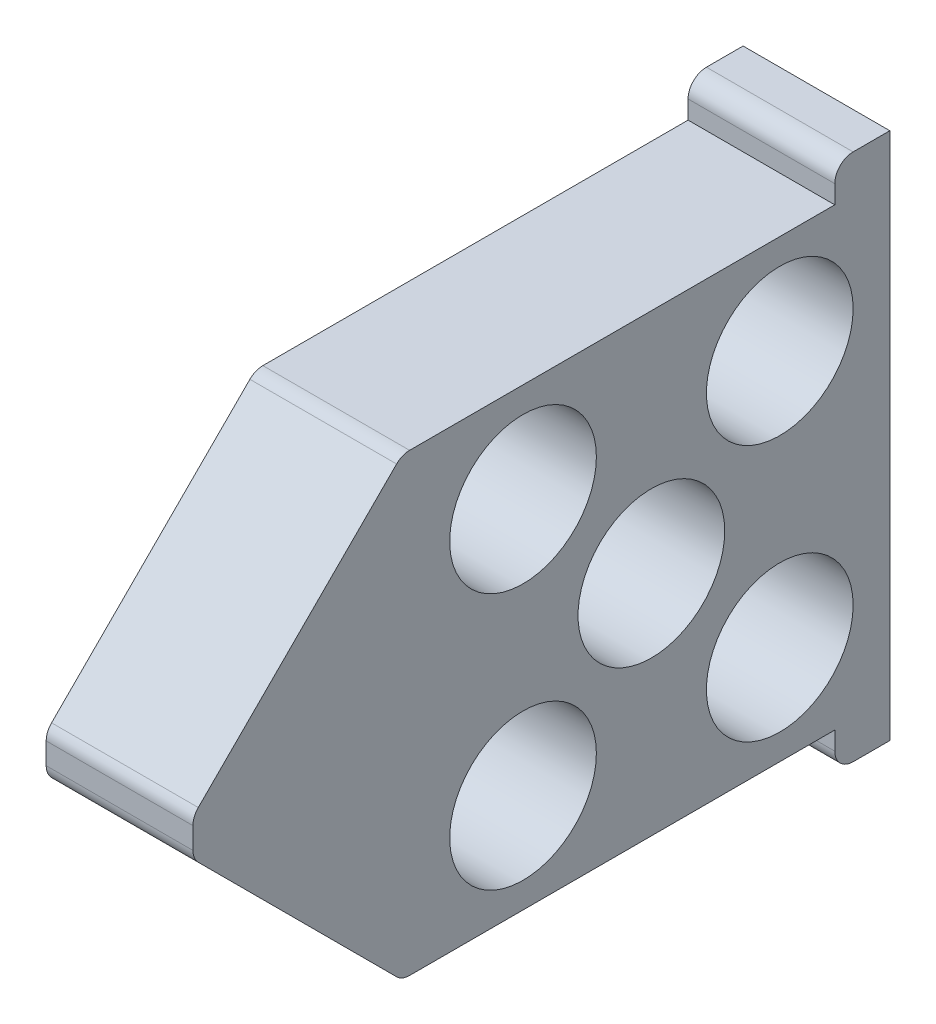
from build123d import *

# Parameters (mm, degrees)
BOSS_EXTRUDE1_DEPTH                = 4
FILLET2_R                          = 0.5
F_4_0MM_MASS_REDUCTION_HOLES_D     = 4
F_4_0MM_MASS_REDUCTION_HOLES_DEPTH = 9.525
F_4_0MM_MASS_REDUCTION_HOLES_TIP   = 1.201721238


with BuildPart() as part:
    # Sketch1 → Boss-Extrude1 (new body)
    with BuildSketch(Plane(origin=(0, 0, 0), x_dir=(0, 0, -1), z_dir=(1, 0, 0))):
        Polygon((-5.8, 6.2), (-11.5, 0.5), (-11.5, -0.5), (-5.8, -6.2), (6, -6.2), (6, -7.2), (7.5, -7.2), (7.5, 7.2), (6, 7.2), (6, 6.2), align=None)
    extrude(amount=BOSS_EXTRUDE1_DEPTH)

    # Fillet2
    fillet2_edges = [part.edges().sort_by_distance(p)[0] for p in [
        (2, -6.2, 5.8),
        (2, -0.5, 11.5),
        (2, 0.5, 11.5),
        (2, 6.2, 5.8),
        (2, 7.2, -6),
        (2, -7.2, -6),
    ]]
    fillet(fillet2_edges, radius=FILLET2_R)

    # Ø4.0mm mass reduction holes
    with Locations(Plane(origin=(4, 0, 0), x_dir=(0, 0, -1), z_dir=(1, 0, 0))):
        with Locations((4.5, -3.5), (4.5, 3.5), (-2.5, -3.5), (-2.5, 3.5), (1, 0)):
            Hole(F_4_0MM_MASS_REDUCTION_HOLES_D / 2, depth=F_4_0MM_MASS_REDUCTION_HOLES_DEPTH)
            with Locations((0, 0, -(F_4_0MM_MASS_REDUCTION_HOLES_DEPTH + F_4_0MM_MASS_REDUCTION_HOLES_TIP / 2))):  # 118° drill point
                Cone(0, F_4_0MM_MASS_REDUCTION_HOLES_D / 2, F_4_0MM_MASS_REDUCTION_HOLES_TIP, mode=Mode.SUBTRACT)


solid = part.part
